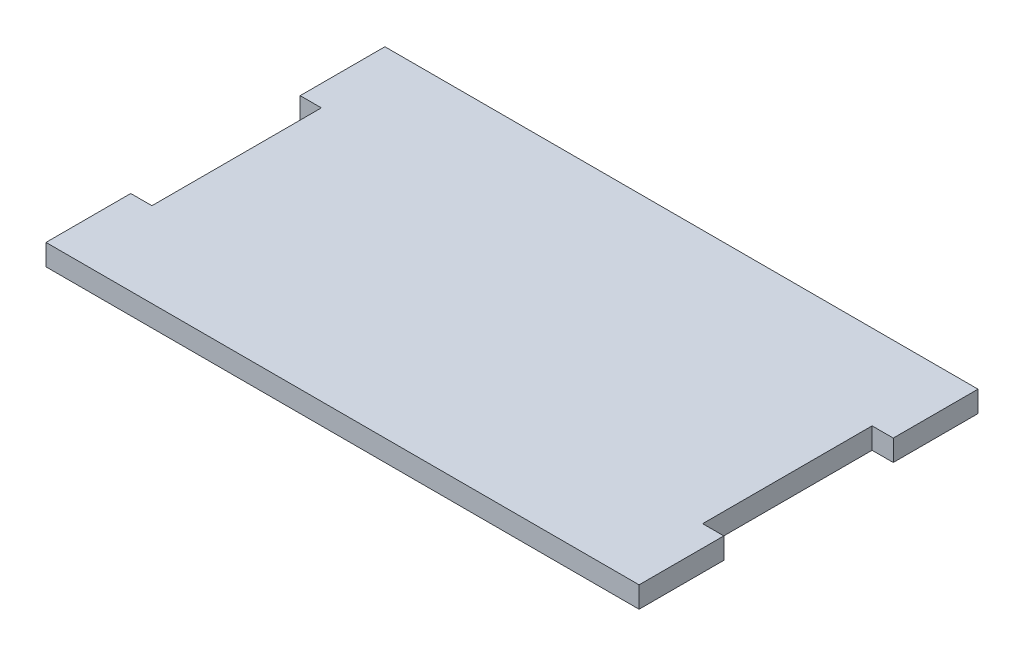
from build123d import *

# Parameters (mm, degrees)
BOSS_EXTRUDE1_DEPTH = 3.175


with BuildPart() as part:
    # Sketch1 → Boss-Extrude1 (new body)
    with BuildSketch(Plane(origin=(0, 0, 0), x_dir=(1, 0, 0), z_dir=(0, 1, 0))):
        Polygon((-41.275, -12.7), (-41.275, 12.7), (-44.45, 12.7), (-44.45, 25.4), (-41.275, 25.4), (41.275, 25.4), (44.45, 25.4), (44.45, 12.7), (41.275, 12.7), (41.275, -12.7), (44.45, -12.7), (44.45, -25.4), (41.275, -25.4), (-41.275, -25.4), (-44.45, -25.4), (-44.45, -12.7), align=None)
    extrude(amount=BOSS_EXTRUDE1_DEPTH)


solid = part.part
